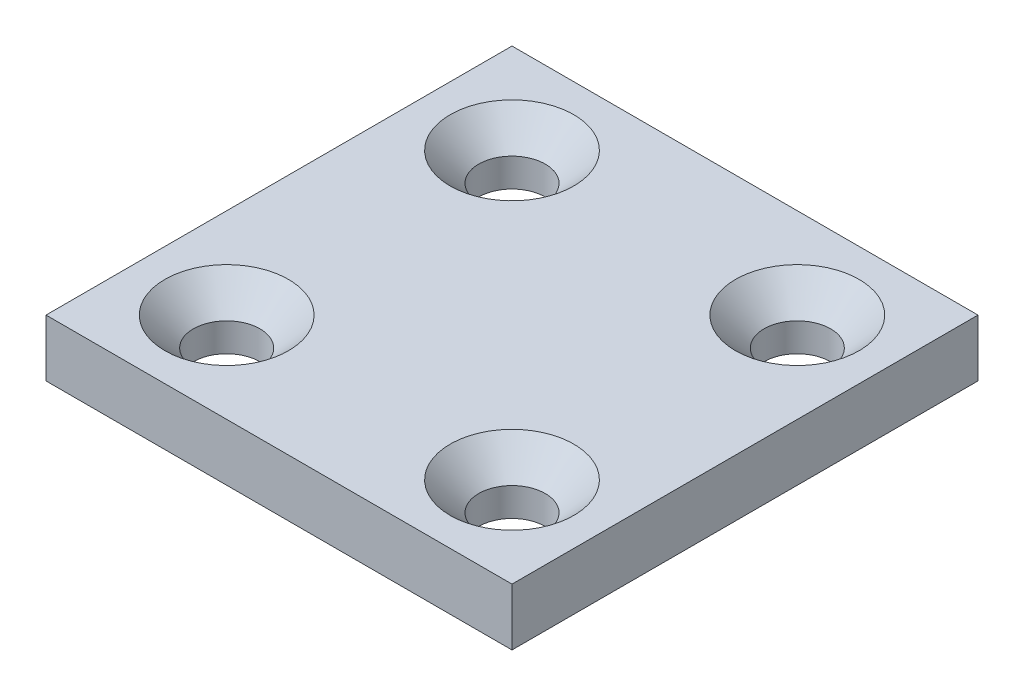
from build123d import *

# Parameters (mm, degrees)
SKETCH_1_W                  = 24.5
SKETCH_1_H                  = 24.5
SKETCH_1_R                  = 1.75
EXTRUDE_1_DEPTH             = 3
HOLE_WIZARD_M3_1_AT_2_COUNT = 2
HOLE_WIZARD_M3_1_AT_2_PITCH = 15
HOLE_WIZARD_M3_1_AT_3_COUNT = 2
HOLE_WIZARD_M3_1_AT_3_PITCH = 21.213203436
HOLE_WIZARD_M3_1_AT_4_COUNT = 2
HOLE_WIZARD_M3_1_AT_4_PITCH = 15


with BuildPart() as part:
    # 草图1 → 凸台-拉伸1 (new body)
    with BuildSketch(Plane(origin=(0, 0, 0), x_dir=(1, 0, 0), z_dir=(0, 1, 0))):
        with Locations((7.5, 7.5)):
            Rectangle(SKETCH_1_W, SKETCH_1_H)
        with Locations(Location((0, 0, 0), (0, 0, 270))):
            Circle(SKETCH_1_R, mode=Mode.SUBTRACT)
        with Locations(Location((15, 0, 0), (0, 0, 270))):
            Circle(SKETCH_1_R, mode=Mode.SUBTRACT)
        with Locations(Location((0, 15, 0), (0, 0, 270))):
            Circle(SKETCH_1_R, mode=Mode.SUBTRACT)
        with Locations(Location((15, 15, 0), (0, 0, 270))):
            Circle(SKETCH_1_R, mode=Mode.SUBTRACT)
    extrude(amount=EXTRUDE_1_DEPTH)

    # 草图5 → M3 平头机械螺钉的锥形沉头孔1 (revolve, cut)
    with BuildSketch(Plane(origin=(0, 3, 0), x_dir=(0, 0, 1), z_dir=(1, 0, 0))):
        Polygon((0, 0), (0, 3), (1.6, 3), (1.6, 1.65), (3.25, 0), align=None)
    hole_wizard_m3_1 = revolve(axis=Axis((0, 9.35, 0), (0, -1, 0)), mode=Mode.SUBTRACT)

    # M3 平头机械螺钉的锥形沉头孔1 at 2: M3 平头机械螺钉的锥形沉头孔1 ×2
    with Locations(*[(i * HOLE_WIZARD_M3_1_AT_2_PITCH, 0, 0) for i in range(1, HOLE_WIZARD_M3_1_AT_2_COUNT)]):
        add(hole_wizard_m3_1, mode=Mode.SUBTRACT)

    # M3 平头机械螺钉的锥形沉头孔1 at 3: M3 平头机械螺钉的锥形沉头孔1 ×2
    with Locations(*[Vector(0.7071067811865476, 0, -0.7071067811865476) * (i * HOLE_WIZARD_M3_1_AT_3_PITCH) for i in range(1, HOLE_WIZARD_M3_1_AT_3_COUNT)]):
        add(hole_wizard_m3_1, mode=Mode.SUBTRACT)

    # M3 平头机械螺钉的锥形沉头孔1 at 4: M3 平头机械螺钉的锥形沉头孔1 ×2
    with Locations(*[(0, 0, -i * HOLE_WIZARD_M3_1_AT_4_PITCH) for i in range(1, HOLE_WIZARD_M3_1_AT_4_COUNT)]):
        add(hole_wizard_m3_1, mode=Mode.SUBTRACT)


solid = part.part
